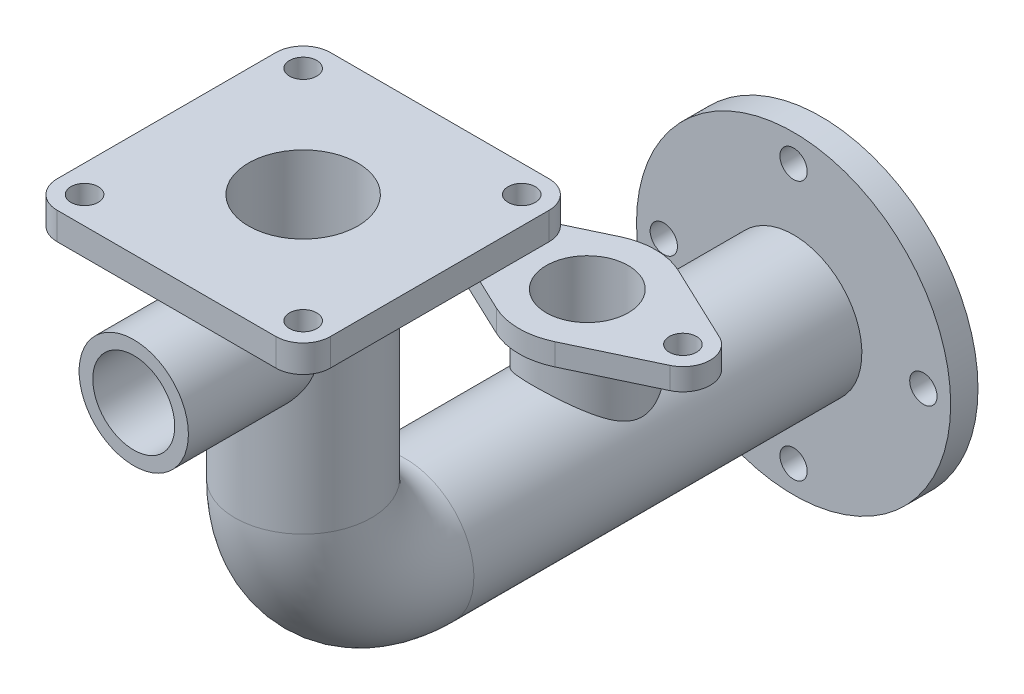
from build123d import *

# Parameters (mm, degrees)
SKETCH1_R                 = 12.5
SKETCH1_R_2               = 10
SKETCH9_W                 = 50
SKETCH9_H                 = 50
SKETCH9_R                 = 10
BOSS_EXTRUDE5_DEPTH       = 5
FILLET1_R                 = 5
HOLE1_D                   = 5
BOSS_EXTRUDE7_START       = -5
SKETCH15_R                = 28.75
SKETCH15_R_2              = 10
BOSS_EXTRUDE7_DEPTH       = 5
HOLE2_D                   = 5
HOLE2_DEPTH               = 5
CIRPATTERN2_COUNT         = 4
BOSS_EXTRUDE8_REACH       = 135.487
BOSS_EXTRUDE8_END_RADIUS  = 12.5
SKETCH20_R                = 10
BOSS_EXTRUDE9_DEPTH       = 4
HOLE3_D                   = 5
HOLE3_DEPTH               = 5
HOLE5_D                   = 15
HOLE5_DEPTH               = 22.75
BOSS_EXTRUDE10_REACH      = 145.888
BOSS_EXTRUDE10_END_RADIUS = 12.5
SKETCH32_R                = 10
HOLE6_REACH               = 145.888
HOLE6_BORE_R              = 7.5


with BuildPart() as part:
    # Sweep1: sweep along a path in Sketch3
    with BuildLine(Plane(origin=(0, 0, 0), x_dir=(0, 0, -1), z_dir=(1, 0, 0))) as sweep1_path:
        Line((0, 0), (-76, 0))
        ThreePointArc((-76, 0), (-89.258252147, 5.491747853), (-94.75, 18.75))
        Line((-94.75, 18.75), (-94.75, 63.75))
    # Sketch1 → Sweep1 (sweep)
    with BuildSketch(Plane.XY):
        Circle(SKETCH1_R)
        Circle(SKETCH1_R_2, mode=Mode.SUBTRACT)
    sweep(path=sweep1_path.line)

    # Sketch9 → Boss-Extrude5 (add)
    with BuildSketch(Plane(origin=(0, 63.75, 0), x_dir=(1, 0, 0), z_dir=(0, 1, 0))):
        with Locations((0, -94.75)):
            Rectangle(SKETCH9_W, SKETCH9_H)
        with Locations(Location((0, -94.75, 0), (0, 0, 270))):
            Circle(SKETCH9_R, mode=Mode.SUBTRACT)
    extrude(amount=-BOSS_EXTRUDE5_DEPTH)

    # Fillet1
    fillet1_edges = [part.edges().sort_by_distance(p)[0] for p in [
        (25, 61.25, 69.75),
        (25, 61.25, 119.75),
        (-25, 61.25, 119.75),
        (-25, 61.25, 69.75),
    ]]
    fillet(fillet1_edges, radius=FILLET1_R)

    # Hole1 (through all)
    with Locations(Plane(origin=(0, 63.75, 0), x_dir=(1, 0, 0), z_dir=(0, 1, 0))):
        with Locations((-20, -74.75), (20, -74.75), (20, -114.75), (-20, -114.75)):
            Hole(HOLE1_D / 2)

    # Sketch15 → Boss-Extrude7 (add)
    with BuildSketch(Plane(origin=(0, 0, 0), x_dir=(-1, 0, 0), z_dir=(0, 0, -1)).offset(BOSS_EXTRUDE7_START)):
        Circle(SKETCH15_R)
        with Locations(Location((0, 0, 0), (0, 0, 180))):
            Circle(SKETCH15_R_2, mode=Mode.SUBTRACT)
    extrude(amount=BOSS_EXTRUDE7_DEPTH)

    # Hole2
    with Locations(Plane(origin=(0, 0, 0), x_dir=(-1, 0, 0), z_dir=(0, 0, -1))):
        with Locations((23.75, 0)):
            hole2 = Hole(HOLE2_D / 2, depth=HOLE2_DEPTH)

    # CirPattern2: Hole2 ×4 about axis
    cirpattern2_axis = Axis((0, 0, 0), (0, 0, 1))
    for i in range(1, CIRPATTERN2_COUNT):
        add(hole2.rotate(cirpattern2_axis, i * 360 / CIRPATTERN2_COUNT), mode=Mode.SUBTRACT)

    # Boss-Extrude8: up to this cylinder (the profile starts outside it)
    boss_extrude8_end = Plane(origin=(0, 0, 42.75), z_dir=(0, 0, 1)) * Cylinder(BOSS_EXTRUDE8_END_RADIUS, 296.974, mode=Mode.PRIVATE)
    # Sketch20 → Boss-Extrude8 (add, up to the surface)
    with BuildSketch(Plane(origin=(0, 22.75, 0), x_dir=(1, 0, 0), z_dir=(0, 1, 0)), mode=Mode.PRIVATE) as boss_extrude8_sk1:
        with Locations(Location((0, -42.75, 0), (0, 0, 270))):
            Circle(SKETCH20_R)
    boss_extrude8_tool1 = extrude(boss_extrude8_sk1.sketch, amount=-BOSS_EXTRUDE8_REACH, mode=Mode.PRIVATE) - boss_extrude8_end
    add(boss_extrude8_tool1.solids().sort_by_distance((0, 22.75, 42.75))[0])

    # Sketch21 → Boss-Extrude9 (add)
    with BuildSketch(Plane(origin=(0, 22.75, 0), x_dir=(1, 0, 0), z_dir=(0, 1, 0))):
        with BuildLine():
            Line((5.357142857, -31.456151214), (19.642857143, -38.232460485))
            ThreePointArc((19.642857143, -38.232460485), (22.5, -42.75), (19.642857143, -47.267539515))
            Line((19.642857143, -47.267539515), (5.357142857, -54.043848786))
            ThreePointArc((5.357142857, -54.043848786), (0, -55.25), (-5.357142857, -54.043848786))
            Line((-5.357142857, -54.043848786), (-19.642857143, -47.267539515))
            ThreePointArc((-19.642857143, -47.267539515), (-22.5, -42.75), (-19.642857143, -38.232460485))
            Line((-19.642857143, -38.232460485), (-5.357142857, -31.456151214))
            ThreePointArc((-5.357142857, -31.456151214), (0, -30.25), (5.357142857, -31.456151214))
        make_face()
    extrude(amount=-BOSS_EXTRUDE9_DEPTH)

    # Hole3
    with Locations(Plane(origin=(0, 22.75, 0), x_dir=(1, 0, 0), z_dir=(0, 1, 0))):
        with Locations((-17.5, -42.75), (17.5, -42.75)):
            Hole(HOLE3_D / 2, depth=HOLE3_DEPTH)

    # Hole5
    with Locations(Plane(origin=(0, 22.75, 0), x_dir=(1, 0, 0), z_dir=(0, 1, 0))):
        with Locations((0, -42.75)):
            Hole(HOLE5_D / 2, depth=HOLE5_DEPTH)

    # Boss-Extrude10: up to this cylinder (the profile starts outside it)
    boss_extrude10_end = Plane(origin=(0, 46.25, 94.75), z_dir=(0, 1, 0)) * Cylinder(BOSS_EXTRUDE10_END_RADIUS, 317.776, mode=Mode.PRIVATE)
    # Sketch32 → Boss-Extrude10 (add, up to the surface)
    with BuildSketch(Plane.XY.offset(125.75), mode=Mode.PRIVATE) as boss_extrude10_sk1:
        with Locations((0, 46.25)):
            Circle(SKETCH32_R)
    boss_extrude10_tool1 = extrude(boss_extrude10_sk1.sketch, amount=-BOSS_EXTRUDE10_REACH, mode=Mode.PRIVATE) - boss_extrude10_end
    add(boss_extrude10_tool1.solids().sort_by_distance((0, 46.25, 125.75))[0])

    # Hole6 bore → Hole6 (cut, up to next)
    with BuildSketch(Plane.XY.offset(125.75), mode=Mode.PRIVATE) as hole6_sk1:
        with Locations((0, 46.25)):
            Circle(HOLE6_BORE_R)
    hole6_tool1 = extrude(hole6_sk1.sketch, amount=-HOLE6_REACH, mode=Mode.PRIVATE) & part.part
    add(hole6_tool1.solids().sort_by_distance((0, 46.25, 125.75))[0], mode=Mode.SUBTRACT)


solid = part.part
